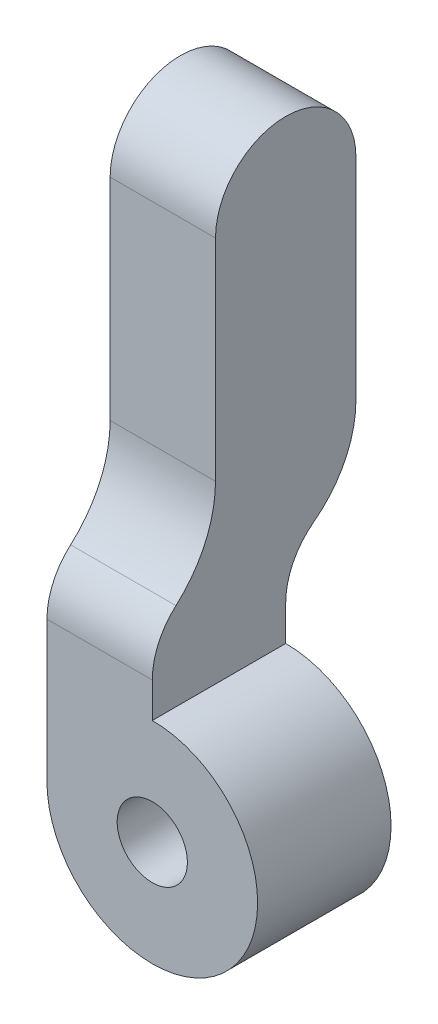
from build123d import *

# Parameters (mm, degrees)
CROQUIS1_R              = 1.5
CROQUIS1_R_2            = 0.5
SALIENTE_EXTRUIR1_DEPTH = 1.9
SALIENTE_EXTRUIR2_DEPTH = 1.5
SALIENTE_EXTRUIR3_START = -1.9
SALIENTE_EXTRUIR3_DEPTH = 1.9


with BuildPart() as part:
    # Croquis1 → Saliente-Extruir1 (new body)
    with BuildSketch(Plane.XY):
        with Locations(Location((0, 0, 0), (0, 0, 180))):
            Circle(CROQUIS1_R)
        Circle(CROQUIS1_R_2, mode=Mode.SUBTRACT)
    extrude(amount=SALIENTE_EXTRUIR1_DEPTH)

    # Croquis2 → Saliente-Extruir2 (add)
    with BuildSketch(Plane(origin=(0, 0, 0), x_dir=(0, 0, -1), z_dir=(1, 0, 0))):
        with BuildLine():
            Line((-1.9, 2), (-1.9, 1))
            Line((-1.9, 1), (0, 1))
            Line((0, 1), (0, 2))
            ThreePointArc((0, 2), (0.105572809, 2.447213595), (0.4, 2.8))
            ThreePointArc((0.4, 2.8), (0.841640786, 3.329179607), (1, 4))
            Line((1, 4), (1, 7))
            ThreePointArc((1, 7), (0, 8), (-1, 7))
            Line((-1, 7), (-1, 4))
            ThreePointArc((-1, 4), (-1.147286816, 3.313779067), (-1.563201663, 2.748440748))
            ThreePointArc((-1.563201663, 2.748440748), (-1.811921505, 2.410364677), (-1.9, 2))
        make_face()
    extrude(amount=-SALIENTE_EXTRUIR2_DEPTH)

    # Croquis3 → Saliente-Extruir3 (add)
    with BuildSketch(Plane.XY.offset(1.9).offset(SALIENTE_EXTRUIR3_START)):
        with BuildLine():
            Line((-1.5, 1), (-1.5, 0))
            ThreePointArc((-1.5, 0), (-1.401258538, 0.535233135), (-1.118033989, 1))
            Line((-1.118033989, 1), (-1.5, 1))
        make_face()
    extrude(amount=SALIENTE_EXTRUIR3_DEPTH)


solid = part.part
